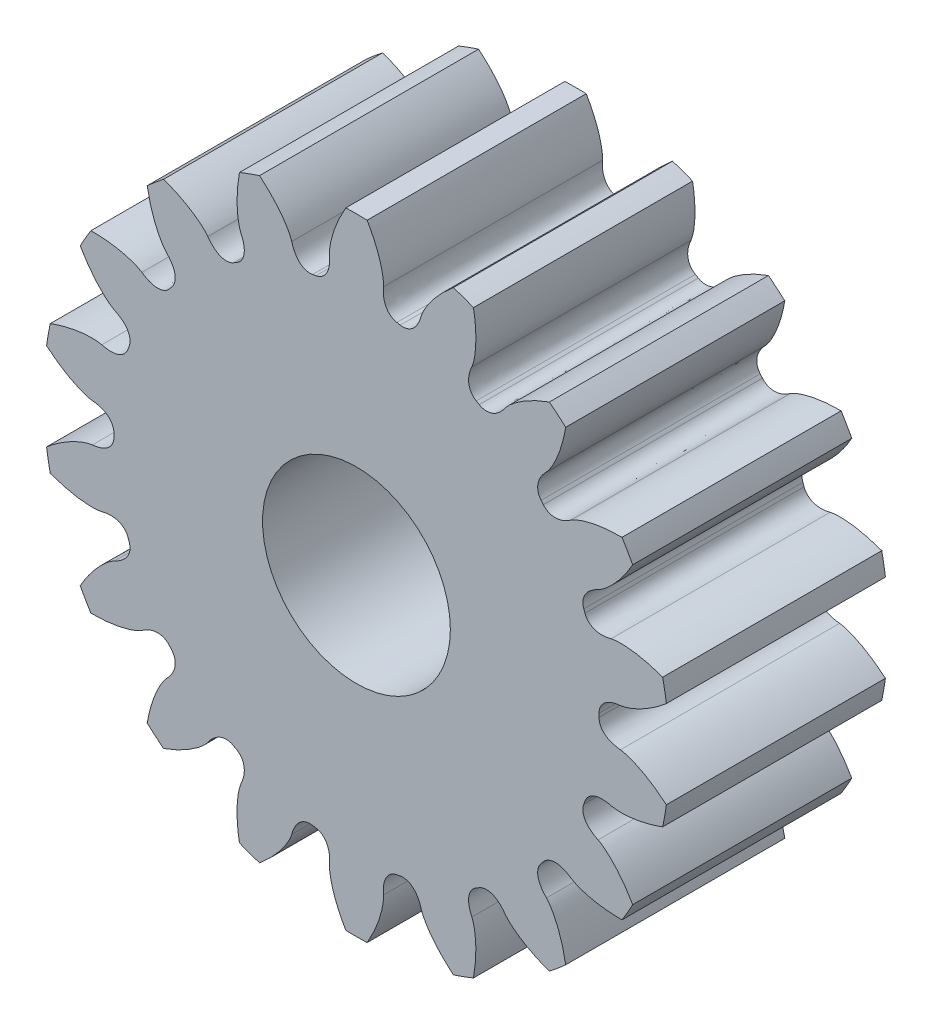
from build123d import *

# Parameters (mm, degrees)
EXTRUDE1_DEPTH = 3.5
SKETCH2_R      = 1.5
EXTRUDE2_DEPTH = 8.858758403


with BuildPart() as part:
    # Model → Extrude1 (new body)
    with BuildSketch(Plane.XY):
        with BuildLine():
            ThreePointArc((0.170382954, 4.997096122), (0, 5), (-0.170382954, 4.997096122))
            add(Edge.make_bspline(
                [(-0.43135347, 4.207267466), (-0.431951062, 4.236199501), (-0.430964789, 4.264988509), (-0.428394651, 4.293634492), (-0.425770912, 4.322877894), (-0.420909378, 4.352020022), (-0.415571578, 4.380917537), (-0.41012826, 4.410386301), (-0.403350915, 4.43967045), (-0.395923916, 4.46870975), (-0.388353419, 4.498310119), (-0.379730019, 4.52768866), (-0.370476347, 4.556810235), (-0.361047462, 4.586483212), (-0.350716716, 4.615909272), (-0.339787808, 4.645065279), (-0.328655911, 4.67476282), (-0.316719407, 4.704193559), (-0.304215266, 4.733341371), (-0.291483172, 4.763020553), (-0.278015717, 4.792415808), (-0.26400773, 4.821515626), (-0.249748986, 4.85113636), (-0.234807532, 4.880457696), (-0.219349459, 4.909471425), (-0.203619566, 4.938995344), (-0.187297397, 4.968203576), (-0.170382954, 4.997096122)],
                knots=[0, 0, 0, 0, 1, 1, 1, 2, 2, 2, 3, 3, 3, 4, 4, 4, 5, 5, 5, 6, 6, 6, 7, 7, 7, 8, 8, 8, 9, 9, 9, 9], degree=3))
            add(Edge.make_bspline(
                [(-0.43135347, 4.207267466), (-0.426410983, 4.162768285), (-0.427129765, 4.118945491), (-0.433509815, 4.075799084), (-0.437167481, 4.051063365), (-0.442075917, 4.025979343), (-0.450064877, 4.00225885), (-0.45584876, 3.98508558), (-0.46276282, 3.967979094), (-0.471301457, 3.951985875), (-0.478339128, 3.938804027), (-0.486355451, 3.925906001), (-0.495389481, 3.913998251), (-0.503410661, 3.903425539), (-0.512275301, 3.893279379), (-0.52182913, 3.884065211), (-0.530697966, 3.875511683), (-0.540288786, 3.867492833), (-0.550350294, 3.860378481), (-0.559957369, 3.853585452), (-0.570172172, 3.847415715), (-0.580688018, 3.842136144), (-0.590923912, 3.836997125), (-0.601655598, 3.832557088), (-0.612541957, 3.828996435), (-0.623293412, 3.825479906), (-0.634306636, 3.822762449), (-0.645581629, 3.820844064)],
                knots=[0, 0, 0, 0, 1, 1, 1, 2, 2, 2, 3, 3, 3, 4, 4, 4, 5, 5, 5, 6, 6, 6, 7, 7, 7, 8, 8, 8, 9, 9, 9, 9], degree=3))
            ThreePointArc((-0.645581629, 3.820844064), (-0.672886688, 3.816130043), (-0.700157341, 3.811220893))
            add(Edge.make_bspline(
                [(-1.033630549, 4.101069767), (-1.023055352, 4.057563785), (-1.007391639, 4.016629667), (-0.986639413, 3.978267412), (-0.974742217, 3.956274435), (-0.961550555, 3.934381948), (-0.945930501, 3.914824361), (-0.934621825, 3.900664971), (-0.922273971, 3.88695488), (-0.908780274, 3.874846556), (-0.897658569, 3.864866696), (-0.885714305, 3.85548826), (-0.873152403, 3.847388455), (-0.861998879, 3.840196761), (-0.850198651, 3.833694375), (-0.838069558, 3.828303491), (-0.826810099, 3.823299124), (-0.815055067, 3.819044124), (-0.803167091, 3.815800059), (-0.791816041, 3.812702513), (-0.780107092, 3.810398525), (-0.768419709, 3.809033981), (-0.757043467, 3.807705765), (-0.745440399, 3.807203948), (-0.733992753, 3.807581383), (-0.722686966, 3.807954141), (-0.711408495, 3.809167311), (-0.700157341, 3.811220893)],
                knots=[0, 0, 0, 0, 1, 1, 1, 2, 2, 2, 3, 3, 3, 4, 4, 4, 5, 5, 5, 6, 6, 6, 7, 7, 7, 8, 8, 8, 9, 9, 9, 9], degree=3))
            add(Edge.make_bspline(
                [(-1.033630549, 4.101069767), (-1.042964335, 4.128461375), (-1.053737549, 4.155176869), (-1.065950192, 4.181216248), (-1.078417533, 4.207798686), (-1.092953075, 4.233520587), (-1.107852498, 4.258849733), (-1.123046455, 4.284679588), (-1.139430845, 4.309879699), (-1.156341967, 4.334627531), (-1.17357983, 4.359853517), (-1.191731228, 4.384510939), (-1.210387, 4.408711326), (-1.229396009, 4.433369934), (-1.249168041, 4.457488062), (-1.269409797, 4.481147841), (-1.290027516, 4.505247067), (-1.311310066, 4.528820391), (-1.333029253, 4.551933707), (-1.355144386, 4.575468383), (-1.377853424, 4.598484746), (-1.400969349, 4.621038616), (-1.424499074, 4.643996224), (-1.448567936, 4.666438989), (-1.473017052, 4.688416004), (-1.497896092, 4.710779472), (-1.523223717, 4.732643722), (-1.548999928, 4.754008753)],
                knots=[0, 0, 0, 0, 1, 1, 1, 2, 2, 2, 3, 3, 3, 4, 4, 4, 5, 5, 5, 6, 6, 6, 7, 7, 7, 8, 8, 8, 9, 9, 9, 9], degree=3))
            ThreePointArc((-1.548999928, 4.754008753), (-1.710100717, 4.698463104), (-1.869215136, 4.637459949))
            add(Edge.make_bspline(
                [(-1.844309894, 3.806006616), (-1.854766786, 3.832989447), (-1.863686414, 3.860379591), (-1.871068777, 3.888177048), (-1.878605101, 3.91655423), (-1.884003949, 3.945601615), (-1.888871589, 3.974582031), (-1.893835454, 4.004135335), (-1.897482602, 4.033971423), (-1.900435531, 4.063799622), (-1.903445513, 4.094204133), (-1.905390221, 4.124760307), (-1.90665478, 4.155290579), (-1.907943282, 4.186398925), (-1.908299861, 4.2175837), (-1.908001988, 4.248719291), (-1.907698584, 4.280433184), (-1.906547845, 4.312171557), (-1.904766935, 4.343838209), (-1.902953558, 4.37608215), (-1.90035206, 4.408310795), (-1.897141581, 4.440446693), (-1.893873632, 4.473157856), (-1.889861745, 4.505821177), (-1.885259189, 4.538372137), (-1.880575699, 4.571495486), (-1.875227681, 4.604524757), (-1.869215136, 4.637459949)],
                knots=[0, 0, 0, 0, 1, 1, 1, 2, 2, 2, 3, 3, 3, 4, 4, 4, 5, 5, 5, 6, 6, 6, 7, 7, 7, 8, 8, 8, 9, 9, 9, 9], degree=3))
            add(Edge.make_bspline(
                [(-1.844309894, 3.806006616), (-1.824445859, 3.765881494), (-1.810133015, 3.7244557), (-1.801371361, 3.681729234), (-1.796348328, 3.657234266), (-1.792381509, 3.631984211), (-1.791775789, 3.606961854), (-1.791337258, 3.588846055), (-1.791983586, 3.570406468), (-1.794537277, 3.552457372), (-1.796642067, 3.537663462), (-1.799763561, 3.522801538), (-1.804180083, 3.508522093), (-1.808101446, 3.495843588), (-1.812961291, 3.483277431), (-1.818787523, 3.471351344), (-1.824196023, 3.460280336), (-1.830465839, 3.449464828), (-1.837487312, 3.439338286), (-1.844191657, 3.429669113), (-1.851680257, 3.420377789), (-1.8597562, 3.411819983), (-1.867617146, 3.403490003), (-1.87618305, 3.39564728), (-1.885195066, 3.388578007), (-1.894095406, 3.381596337), (-1.903515026, 3.375276018), (-1.913453928, 3.369617051)],
                knots=[0, 0, 0, 0, 1, 1, 1, 2, 2, 2, 3, 3, 3, 4, 4, 4, 5, 5, 5, 6, 6, 6, 7, 7, 7, 8, 8, 8, 9, 9, 9, 9], degree=3))
            ThreePointArc((-1.913453928, 3.369617051), (-1.9375, 3.35584844), (-1.961447003, 3.341908235))
            add(Edge.make_bspline(
                [(-2.373943469, 3.500222529), (-2.349126112, 3.462957209), (-2.320406744, 3.429849025), (-2.287785366, 3.400897977), (-2.269083617, 3.384300419), (-2.249199838, 3.368240026), (-2.227832701, 3.355204278), (-2.212363225, 3.345766599), (-2.19607091, 3.337106542), (-2.179249692, 3.330343556), (-2.165385394, 3.324769402), (-2.150953843, 3.320041734), (-2.136379221, 3.316726831), (-2.123438632, 3.313783578), (-2.110126099, 3.31170925), (-2.096884688, 3.31079187), (-2.084592663, 3.309940266), (-2.072091251, 3.309962331), (-2.059810672, 3.310979834), (-2.048084751, 3.311951381), (-2.036293927, 3.313791036), (-2.024844678, 3.316506106), (-2.013700231, 3.319148895), (-2.002625282, 3.322645824), (-1.991997104, 3.326915822), (-1.98150063, 3.331132907), (-1.971317263, 3.336130378), (-1.961447003, 3.341908235)],
                knots=[0, 0, 0, 0, 1, 1, 1, 2, 2, 2, 3, 3, 3, 4, 4, 4, 5, 5, 5, 6, 6, 6, 7, 7, 7, 8, 8, 8, 9, 9, 9, 9], degree=3))
            add(Edge.make_bspline(
                [(-2.373943469, 3.500222529), (-2.39208284, 3.522769878), (-2.411343587, 3.544189574), (-2.43172571, 3.564481617), (-2.452532908, 3.585196856), (-2.474989257, 3.604396088), (-2.497653214, 3.623101797), (-2.520765194, 3.642177282), (-2.544780429, 3.660253848), (-2.569135943, 3.677725259), (-2.593962031, 3.695534236), (-2.6194521, 3.712496489), (-2.645259812, 3.728856765), (-2.671556178, 3.745526813), (-2.698384696, 3.761428007), (-2.725497846, 3.776737838), (-2.753114585, 3.792332028), (-2.781176191, 3.807204646), (-2.809490771, 3.821495658), (-2.838321532, 3.836047199), (-2.867533107, 3.849908557), (-2.89696885, 3.863196151), (-2.926931522, 3.876721605), (-2.957224732, 3.88957887), (-2.987715968, 3.901868418), (-3.018743375, 3.914374072), (-3.050021571, 3.926257188), (-3.081550557, 3.937517767)],
                knots=[0, 0, 0, 0, 1, 1, 1, 2, 2, 2, 3, 3, 3, 4, 4, 4, 5, 5, 5, 6, 6, 6, 7, 7, 7, 8, 8, 8, 9, 9, 9, 9], degree=3))
            ThreePointArc((-3.081550557, 3.937517767), (-3.213938048, 3.830222216), (-3.342592386, 3.718477664))
            add(Edge.make_bspline(
                [(-3.034815326, 2.945685197), (-3.053870262, 2.967464297), (-3.071619951, 2.990151921), (-3.088064394, 3.013748069), (-3.10485179, 3.037836323), (-3.119859838, 3.063285421), (-3.13434581, 3.088853274), (-3.149118143, 3.114926554), (-3.162749884, 3.141715907), (-3.175726574, 3.168735285), (-3.188953987, 3.196276704), (-3.201232242, 3.224324987), (-3.212862506, 3.252581553), (-3.224712983, 3.281373143), (-3.235713879, 3.310555288), (-3.24608297, 3.339915052), (-3.256644653, 3.369820134), (-3.266418475, 3.400038025), (-3.2755756, 3.430404051), (-3.284899661, 3.461323655), (-3.293477897, 3.492498441), (-3.301452159, 3.523794355), (-3.309569168, 3.555650497), (-3.316970741, 3.587716126), (-3.323778837, 3.619878189), (-3.330706648, 3.652605804), (-3.336977831, 3.685472296), (-3.342592386, 3.718477664)],
                knots=[0, 0, 0, 0, 1, 1, 1, 2, 2, 2, 3, 3, 3, 4, 4, 4, 5, 5, 5, 6, 6, 6, 7, 7, 7, 8, 8, 8, 9, 9, 9, 9], degree=3))
            add(Edge.make_bspline(
                [(-3.034815326, 2.945685197), (-3.002425639, 2.914773816), (-2.974807509, 2.880741585), (-2.951960936, 2.843588502), (-2.938863056, 2.822288739), (-2.926499438, 2.799918181), (-2.917372097, 2.776612025), (-2.910764044, 2.759738729), (-2.905064684, 2.742190128), (-2.901325417, 2.724450082), (-2.898243457, 2.709828473), (-2.896093624, 2.694795218), (-2.895359939, 2.67986639), (-2.894708511, 2.666611307), (-2.894977393, 2.653140818), (-2.896373298, 2.639941273), (-2.897669118, 2.627688112), (-2.899861696, 2.615380456), (-2.902996241, 2.603463134), (-2.905989213, 2.592084063), (-2.909848375, 2.580791821), (-2.914510337, 2.569987979), (-2.919048189, 2.559471757), (-2.924415137, 2.549172296), (-2.930465828, 2.539447062), (-2.93644154, 2.529842342), (-2.943131411, 2.520681485), (-2.950535442, 2.511964491)],
                knots=[0, 0, 0, 0, 1, 1, 1, 2, 2, 2, 3, 3, 3, 4, 4, 4, 5, 5, 5, 6, 6, 6, 7, 7, 7, 8, 8, 8, 9, 9, 9, 9], degree=3))
            ThreePointArc((-2.950535442, 2.511964491), (-2.968422217, 2.490801988), (-2.986157208, 2.469512123))
            add(Edge.make_bspline(
                [(-3.427923771, 2.477196796), (-3.391857593, 2.450666886), (-3.35354655, 2.429377972), (-3.31299064, 2.413330055), (-3.289740046, 2.404129826), (-3.265562427, 2.395838646), (-3.241025398, 2.390897042), (-3.223260969, 2.387319397), (-3.204989287, 2.384753905), (-3.186869435, 2.384151972), (-3.171934784, 2.38365585), (-3.156756604, 2.384149176), (-3.141927175, 2.386019001), (-3.128760348, 2.38767919), (-3.115541196, 2.390283114), (-3.102784578, 2.393949888), (-3.090942587, 2.397353761), (-3.079202649, 2.401650231), (-3.068010686, 2.406806576), (-3.057324213, 2.411730033), (-3.046873662, 2.417491443), (-3.037043496, 2.423958647), (-3.027475028, 2.430253682), (-3.018264, 2.437327576), (-3.009737206, 2.444975113), (-3.001316074, 2.452527882), (-2.993456075, 2.460706885), (-2.986157208, 2.469512123)],
                knots=[0, 0, 0, 0, 1, 1, 1, 2, 2, 2, 3, 3, 3, 4, 4, 4, 5, 5, 5, 6, 6, 6, 7, 7, 7, 8, 8, 8, 9, 9, 9, 9], degree=3))
            add(Edge.make_bspline(
                [(-3.427923771, 2.477196796), (-3.452680852, 2.492180344), (-3.478106001, 2.505720711), (-3.504199219, 2.517817897), (-3.530836618, 2.530167373), (-3.558505208, 2.540528226), (-3.58620009, 2.550354312), (-3.614442447, 2.560374642), (-3.643191937, 2.569147364), (-3.672054208, 2.577235044), (-3.701474128, 2.585478986), (-3.73122839, 2.592700173), (-3.76107525, 2.599247046), (-3.791487244, 2.60591788), (-3.822136333, 2.611684221), (-3.85285063, 2.616797513), (-3.884135403, 2.622005777), (-3.915591423, 2.626383832), (-3.947086239, 2.630128834), (-3.979155211, 2.633942109), (-4.011345977, 2.636976578), (-4.043551152, 2.639395214), (-4.076332832, 2.641857146), (-4.109196581, 2.643578135), (-4.142052244, 2.644697917), (-4.175485654, 2.645837388), (-4.20894181, 2.646306092), (-4.24242071, 2.646104027)],
                knots=[0, 0, 0, 0, 1, 1, 1, 2, 2, 2, 3, 3, 3, 4, 4, 4, 5, 5, 5, 6, 6, 6, 7, 7, 7, 8, 8, 8, 9, 9, 9, 9], degree=3))
            ThreePointArc((-4.24242071, 2.646104027), (-4.330127019, 2.5), (-4.412803663, 2.350992095))
            add(Edge.make_bspline(
                [(-3.859277241, 1.73007067), (-3.884631914, 1.744019157), (-3.909070791, 1.759267799), (-3.93259387, 1.775816595), (-3.95660753, 1.792710521), (-3.979414586, 1.811491797), (-4.001771668, 1.830563225), (-4.024570707, 1.850011658), (-4.046542852, 1.870523086), (-4.067978123, 1.891474706), (-4.089827546, 1.912831133), (-4.11095841, 1.934988487), (-4.131551598, 1.957563189), (-4.152534707, 1.980565332), (-4.172853049, 2.00422505), (-4.192638438, 2.028267766), (-4.212791314, 2.052757042), (-4.23231083, 2.077809727), (-4.251301505, 2.103212537), (-4.270638384, 2.129078444), (-4.289361694, 2.15543923), (-4.307558882, 2.182120412), (-4.326081818, 2.209279213), (-4.344004113, 2.236879561), (-4.361401703, 2.264773509), (-4.37910522, 2.293157956), (-4.396239207, 2.321897484), (-4.412803663, 2.350992095)],
                knots=[0, 0, 0, 0, 1, 1, 1, 2, 2, 2, 3, 3, 3, 4, 4, 4, 5, 5, 5, 6, 6, 6, 7, 7, 7, 8, 8, 8, 9, 9, 9, 9], degree=3))
            add(Edge.make_bspline(
                [(-3.859277241, 1.73007067), (-3.818268576, 1.712101399), (-3.780676314, 1.689567519), (-3.746500455, 1.662469029), (-3.726907527, 1.646933538), (-3.707638344, 1.630140697), (-3.691090275, 1.611361808), (-3.679109729, 1.597766184), (-3.667752107, 1.583225188), (-3.658170892, 1.567833903), (-3.650273912, 1.555148177), (-3.643112055, 1.541756825), (-3.637316656, 1.52797925), (-3.632171009, 1.515746348), (-3.627816497, 1.502996265), (-3.624613707, 1.490115323), (-3.621640553, 1.478157921), (-3.619491436, 1.465842602), (-3.61836098, 1.453571905), (-3.617281582, 1.441855419), (-3.617045834, 1.429924272), (-3.617731514, 1.418177497), (-3.61839894, 1.406743443), (-3.619919599, 1.395229511), (-3.622279162, 1.384021322), (-3.624609487, 1.372952024), (-3.627762712, 1.362055564), (-3.631738838, 1.351331941)],
                knots=[0, 0, 0, 0, 1, 1, 1, 2, 2, 2, 3, 3, 3, 4, 4, 4, 5, 5, 5, 6, 6, 6, 7, 7, 7, 8, 8, 8, 9, 9, 9, 9], degree=3))
            ThreePointArc((-3.631738838, 1.351331941), (-3.641308906, 1.325328055), (-3.650692784, 1.299256403))
            add(Edge.make_bspline(
                [(-4.068445875, 1.15538457), (-4.025480991, 1.142789968), (-3.982199149, 1.135888082), (-3.938600348, 1.13467891), (-3.913605273, 1.133985695), (-3.888049993, 1.134463767), (-3.863302599, 1.138212336), (-3.845385869, 1.140926242), (-3.827338655, 1.144764752), (-3.81010569, 1.150396474), (-3.795902025, 1.155038224), (-3.781807929, 1.160693041), (-3.768512342, 1.167522065), (-3.75670739, 1.173585453), (-3.745176045, 1.180553557), (-3.734442856, 1.188362218), (-3.724479217, 1.195611012), (-3.714916763, 1.203663668), (-3.706163332, 1.212336925), (-3.697805254, 1.22061845), (-3.689955467, 1.229606703), (-3.682930046, 1.239046002), (-3.676091656, 1.248234008), (-3.669855536, 1.258031652), (-3.664458581, 1.268134322), (-3.659128505, 1.278111799), (-3.654539906, 1.288485826), (-3.650692784, 1.299256403)],
                knots=[0, 0, 0, 0, 1, 1, 1, 2, 2, 2, 3, 3, 3, 4, 4, 4, 5, 5, 5, 6, 6, 6, 7, 7, 7, 8, 8, 8, 9, 9, 9, 9], degree=3))
            add(Edge.make_bspline(
                [(-4.068445875, 1.15538457), (-4.096834597, 1.160997079), (-4.1253575, 1.165024948), (-4.154014586, 1.167468179), (-4.183269323, 1.169962364), (-4.212812913, 1.170235165), (-4.242198309, 1.169996459), (-4.272164598, 1.169753034), (-4.302180729, 1.168163792), (-4.332068541, 1.165892246), (-4.362533817, 1.163576812), (-4.39296347, 1.160185952), (-4.423249506, 1.156129773), (-4.454108992, 1.151996792), (-4.48488192, 1.146932774), (-4.515492767, 1.141232789), (-4.546672168, 1.135426933), (-4.577728541, 1.128782367), (-4.608604853, 1.121529656), (-4.640044047, 1.114144727), (-4.671331321, 1.105986306), (-4.702421508, 1.097244262), (-4.734068242, 1.088345726), (-4.765538677, 1.078722863), (-4.796795889, 1.068537814), (-4.82860274, 1.058173668), (-4.860201549, 1.047171426), (-4.891592314, 1.035531089)],
                knots=[0, 0, 0, 0, 1, 1, 1, 2, 2, 2, 3, 3, 3, 4, 4, 4, 5, 5, 5, 6, 6, 6, 7, 7, 7, 8, 8, 8, 9, 9, 9, 9], degree=3))
            ThreePointArc((-4.891592314, 1.035531089), (-4.924038765, 0.868240888), (-4.950765693, 0.699942181))
            add(Edge.make_bspline(
                [(-4.218253363, 0.305784087), (-4.246849626, 0.310219568), (-4.275030001, 0.316190016), (-4.302794487, 0.323695431), (-4.331138009, 0.331357374), (-4.358993206, 0.341205527), (-4.386524803, 0.351480235), (-4.414600648, 0.361958054), (-4.442263032, 0.373717574), (-4.469571474, 0.386074363), (-4.497407544, 0.398669897), (-4.524842321, 0.412263818), (-4.551914591, 0.426433814), (-4.57949946, 0.440872112), (-4.606684557, 0.456155692), (-4.633499834, 0.471981453), (-4.660813168, 0.488101156), (-4.687724036, 0.504966911), (-4.714257706, 0.522342551), (-4.74127509, 0.540034951), (-4.767885166, 0.558402238), (-4.794110431, 0.577250542), (-4.820805154, 0.596436251), (-4.847086477, 0.616242308), (-4.872975156, 0.636503718), (-4.899319073, 0.657121414), (-4.925249252, 0.678267569), (-4.950765693, 0.699942181)],
                knots=[0, 0, 0, 0, 1, 1, 1, 2, 2, 2, 3, 3, 3, 4, 4, 4, 5, 5, 5, 6, 6, 6, 7, 7, 7, 8, 8, 8, 9, 9, 9, 9], degree=3))
            add(Edge.make_bspline(
                [(-4.218253363, 0.305784087), (-4.173571971, 0.302924285), (-4.130539759, 0.294606675), (-4.089156727, 0.280831257), (-4.065431946, 0.272933846), (-4.041581347, 0.263744186), (-4.01960849, 0.251757575), (-4.003700482, 0.243079456), (-3.988054496, 0.233299925), (-3.973786969, 0.222113816), (-3.962027461, 0.212894059), (-3.950717405, 0.202759804), (-3.940559303, 0.191795262), (-3.931540078, 0.18206001), (-3.92308739, 0.171568182), (-3.91567221, 0.160559473), (-3.908788686, 0.15034007), (-3.90255709, 0.139502497), (-3.897297983, 0.128358452), (-3.892276407, 0.117717733), (-3.887974184, 0.106586752), (-3.884600879, 0.095313877), (-3.881317377, 0.084341108), (-3.878808332, 0.073001456), (-3.87719217, 0.061662185), (-3.875596036, 0.05046343), (-3.874832289, 0.03914564), (-3.874900931, 0.027708815)],
                knots=[0, 0, 0, 0, 1, 1, 1, 2, 2, 2, 3, 3, 3, 4, 4, 4, 5, 5, 5, 6, 6, 6, 7, 7, 7, 8, 8, 8, 9, 9, 9, 9], degree=3))
            ThreePointArc((-3.874900931, 0.027708815), (-3.875, 0), (-3.874900931, -0.027708815))
            add(Edge.make_bspline(
                [(-4.218253363, -0.305784087), (-4.173571971, -0.302924285), (-4.130539759, -0.294606675), (-4.089156727, -0.280831257), (-4.065431946, -0.272933846), (-4.041581347, -0.263744186), (-4.01960849, -0.251757575), (-4.003700482, -0.243079456), (-3.988054496, -0.233299925), (-3.973786969, -0.222113816), (-3.962027461, -0.212894059), (-3.950717405, -0.202759804), (-3.940559303, -0.191795262), (-3.931540078, -0.18206001), (-3.92308739, -0.171568182), (-3.91567221, -0.160559473), (-3.908788686, -0.15034007), (-3.90255709, -0.139502497), (-3.897297983, -0.128358452), (-3.892276407, -0.117717733), (-3.887974184, -0.106586752), (-3.884600879, -0.095313877), (-3.881317377, -0.084341108), (-3.878808332, -0.073001456), (-3.87719217, -0.061662185), (-3.875596036, -0.05046343), (-3.874832289, -0.03914564), (-3.874900931, -0.027708815)],
                knots=[0, 0, 0, 0, 1, 1, 1, 2, 2, 2, 3, 3, 3, 4, 4, 4, 5, 5, 5, 6, 6, 6, 7, 7, 7, 8, 8, 8, 9, 9, 9, 9], degree=3))
            add(Edge.make_bspline(
                [(-4.218253363, -0.305784087), (-4.246849626, -0.310219568), (-4.275030001, -0.316190016), (-4.302794487, -0.323695431), (-4.331138009, -0.331357374), (-4.358993206, -0.341205527), (-4.386524803, -0.351480235), (-4.414600648, -0.361958054), (-4.442263032, -0.373717574), (-4.469571474, -0.386074363), (-4.497407544, -0.398669897), (-4.524842321, -0.412263818), (-4.551914591, -0.426433814), (-4.57949946, -0.440872112), (-4.606684557, -0.456155692), (-4.633499834, -0.471981453), (-4.660813168, -0.488101156), (-4.687724036, -0.504966911), (-4.714257706, -0.522342551), (-4.74127509, -0.540034951), (-4.767885166, -0.558402238), (-4.794110431, -0.577250542), (-4.820805154, -0.596436251), (-4.847086477, -0.616242308), (-4.872975156, -0.636503718), (-4.899319073, -0.657121414), (-4.925249252, -0.678267569), (-4.950765693, -0.699942181)],
                knots=[0, 0, 0, 0, 1, 1, 1, 2, 2, 2, 3, 3, 3, 4, 4, 4, 5, 5, 5, 6, 6, 6, 7, 7, 7, 8, 8, 8, 9, 9, 9, 9], degree=3))
            ThreePointArc((-4.950765693, -0.699942181), (-4.924038765, -0.868240888), (-4.891592314, -1.035531089))
            add(Edge.make_bspline(
                [(-4.068445875, -1.15538457), (-4.096834597, -1.160997079), (-4.1253575, -1.165024948), (-4.154014586, -1.167468179), (-4.183269323, -1.169962364), (-4.212812913, -1.170235165), (-4.242198309, -1.169996459), (-4.272164598, -1.169753034), (-4.302180729, -1.168163792), (-4.332068541, -1.165892246), (-4.362533817, -1.163576812), (-4.39296347, -1.160185952), (-4.423249506, -1.156129773), (-4.454108992, -1.151996792), (-4.48488192, -1.146932774), (-4.515492767, -1.141232789), (-4.546672168, -1.135426933), (-4.577728541, -1.128782367), (-4.608604853, -1.121529656), (-4.640044047, -1.114144727), (-4.671331321, -1.105986306), (-4.702421508, -1.097244262), (-4.734068242, -1.088345726), (-4.765538677, -1.078722863), (-4.796795889, -1.068537814), (-4.82860274, -1.058173668), (-4.860201549, -1.047171426), (-4.891592314, -1.035531089)],
                knots=[0, 0, 0, 0, 1, 1, 1, 2, 2, 2, 3, 3, 3, 4, 4, 4, 5, 5, 5, 6, 6, 6, 7, 7, 7, 8, 8, 8, 9, 9, 9, 9], degree=3))
            add(Edge.make_bspline(
                [(-4.068445875, -1.15538457), (-4.025480991, -1.142789968), (-3.982199149, -1.135888082), (-3.938600348, -1.13467891), (-3.913605273, -1.133985695), (-3.888049993, -1.134463767), (-3.863302599, -1.138212336), (-3.845385869, -1.140926242), (-3.827338655, -1.144764752), (-3.81010569, -1.150396474), (-3.795902025, -1.155038224), (-3.781807929, -1.160693041), (-3.768512342, -1.167522065), (-3.75670739, -1.173585453), (-3.745176045, -1.180553557), (-3.734442856, -1.188362218), (-3.724479217, -1.195611012), (-3.714916763, -1.203663668), (-3.706163332, -1.212336925), (-3.697805254, -1.22061845), (-3.689955467, -1.229606703), (-3.682930046, -1.239046002), (-3.676091656, -1.248234008), (-3.669855536, -1.258031652), (-3.664458581, -1.268134322), (-3.659128505, -1.278111799), (-3.654539906, -1.288485826), (-3.650692784, -1.299256403)],
                knots=[0, 0, 0, 0, 1, 1, 1, 2, 2, 2, 3, 3, 3, 4, 4, 4, 5, 5, 5, 6, 6, 6, 7, 7, 7, 8, 8, 8, 9, 9, 9, 9], degree=3))
            ThreePointArc((-3.650692784, -1.299256403), (-3.641308906, -1.325328055), (-3.631738838, -1.351331941))
            add(Edge.make_bspline(
                [(-3.859277241, -1.73007067), (-3.818268576, -1.712101399), (-3.780676314, -1.689567519), (-3.746500455, -1.662469029), (-3.726907527, -1.646933538), (-3.707638344, -1.630140697), (-3.691090275, -1.611361808), (-3.679109729, -1.597766184), (-3.667752107, -1.583225188), (-3.658170892, -1.567833903), (-3.650273912, -1.555148177), (-3.643112055, -1.541756825), (-3.637316656, -1.52797925), (-3.632171009, -1.515746348), (-3.627816497, -1.502996265), (-3.624613707, -1.490115323), (-3.621640553, -1.478157921), (-3.619491436, -1.465842602), (-3.61836098, -1.453571905), (-3.617281582, -1.441855419), (-3.617045834, -1.429924272), (-3.617731514, -1.418177497), (-3.61839894, -1.406743443), (-3.619919599, -1.395229511), (-3.622279162, -1.384021322), (-3.624609487, -1.372952024), (-3.627762712, -1.362055564), (-3.631738838, -1.351331941)],
                knots=[0, 0, 0, 0, 1, 1, 1, 2, 2, 2, 3, 3, 3, 4, 4, 4, 5, 5, 5, 6, 6, 6, 7, 7, 7, 8, 8, 8, 9, 9, 9, 9], degree=3))
            add(Edge.make_bspline(
                [(-3.859277241, -1.73007067), (-3.884631914, -1.744019157), (-3.909070791, -1.759267799), (-3.93259387, -1.775816595), (-3.95660753, -1.792710521), (-3.979414586, -1.811491797), (-4.001771668, -1.830563225), (-4.024570707, -1.850011658), (-4.046542852, -1.870523086), (-4.067978123, -1.891474706), (-4.089827546, -1.912831133), (-4.11095841, -1.934988487), (-4.131551598, -1.957563189), (-4.152534707, -1.980565332), (-4.172853049, -2.00422505), (-4.192638438, -2.028267766), (-4.212791314, -2.052757042), (-4.23231083, -2.077809727), (-4.251301505, -2.103212537), (-4.270638384, -2.129078444), (-4.289361694, -2.15543923), (-4.307558882, -2.182120412), (-4.326081818, -2.209279213), (-4.344004113, -2.236879561), (-4.361401703, -2.264773509), (-4.37910522, -2.293157956), (-4.396239207, -2.321897484), (-4.412803663, -2.350992095)],
                knots=[0, 0, 0, 0, 1, 1, 1, 2, 2, 2, 3, 3, 3, 4, 4, 4, 5, 5, 5, 6, 6, 6, 7, 7, 7, 8, 8, 8, 9, 9, 9, 9], degree=3))
            ThreePointArc((-4.412803663, -2.350992095), (-4.330127019, -2.5), (-4.24242071, -2.646104027))
            add(Edge.make_bspline(
                [(-3.427923771, -2.477196796), (-3.452680852, -2.492180344), (-3.478106001, -2.505720711), (-3.504199219, -2.517817897), (-3.530836618, -2.530167373), (-3.558505208, -2.540528226), (-3.58620009, -2.550354312), (-3.614442447, -2.560374642), (-3.643191937, -2.569147364), (-3.672054208, -2.577235044), (-3.701474128, -2.585478986), (-3.73122839, -2.592700173), (-3.76107525, -2.599247046), (-3.791487244, -2.60591788), (-3.822136333, -2.611684221), (-3.85285063, -2.616797513), (-3.884135403, -2.622005777), (-3.915591423, -2.626383832), (-3.947086239, -2.630128834), (-3.979155211, -2.633942109), (-4.011345977, -2.636976578), (-4.043551152, -2.639395214), (-4.076332832, -2.641857146), (-4.109196581, -2.643578135), (-4.142052244, -2.644697917), (-4.175485654, -2.645837388), (-4.20894181, -2.646306092), (-4.24242071, -2.646104027)],
                knots=[0, 0, 0, 0, 1, 1, 1, 2, 2, 2, 3, 3, 3, 4, 4, 4, 5, 5, 5, 6, 6, 6, 7, 7, 7, 8, 8, 8, 9, 9, 9, 9], degree=3))
            add(Edge.make_bspline(
                [(-3.427923771, -2.477196796), (-3.391857593, -2.450666886), (-3.35354655, -2.429377972), (-3.31299064, -2.413330055), (-3.289740046, -2.404129826), (-3.265562427, -2.395838646), (-3.241025398, -2.390897042), (-3.223260969, -2.387319397), (-3.204989287, -2.384753905), (-3.186869435, -2.384151972), (-3.171934784, -2.38365585), (-3.156756604, -2.384149176), (-3.141927175, -2.386019001), (-3.128760348, -2.38767919), (-3.115541196, -2.390283114), (-3.102784578, -2.393949888), (-3.090942587, -2.397353761), (-3.079202649, -2.401650231), (-3.068010686, -2.406806576), (-3.057324213, -2.411730033), (-3.046873662, -2.417491443), (-3.037043496, -2.423958647), (-3.027475028, -2.430253682), (-3.018264, -2.437327576), (-3.009737206, -2.444975113), (-3.001316074, -2.452527882), (-2.993456075, -2.460706885), (-2.986157208, -2.469512123)],
                knots=[0, 0, 0, 0, 1, 1, 1, 2, 2, 2, 3, 3, 3, 4, 4, 4, 5, 5, 5, 6, 6, 6, 7, 7, 7, 8, 8, 8, 9, 9, 9, 9], degree=3))
            ThreePointArc((-2.986157208, -2.469512123), (-2.968422217, -2.490801988), (-2.950535442, -2.511964491))
            add(Edge.make_bspline(
                [(-3.034815326, -2.945685197), (-3.002425639, -2.914773816), (-2.974807509, -2.880741585), (-2.951960936, -2.843588502), (-2.938863056, -2.822288739), (-2.926499438, -2.799918181), (-2.917372097, -2.776612025), (-2.910764044, -2.759738729), (-2.905064684, -2.742190128), (-2.901325417, -2.724450082), (-2.898243457, -2.709828473), (-2.896093624, -2.694795218), (-2.895359939, -2.67986639), (-2.894708511, -2.666611307), (-2.894977393, -2.653140818), (-2.896373298, -2.639941273), (-2.897669118, -2.627688112), (-2.899861696, -2.615380456), (-2.902996241, -2.603463134), (-2.905989213, -2.592084063), (-2.909848375, -2.580791821), (-2.914510337, -2.569987979), (-2.919048189, -2.559471757), (-2.924415137, -2.549172296), (-2.930465828, -2.539447062), (-2.93644154, -2.529842342), (-2.943131411, -2.520681485), (-2.950535442, -2.511964491)],
                knots=[0, 0, 0, 0, 1, 1, 1, 2, 2, 2, 3, 3, 3, 4, 4, 4, 5, 5, 5, 6, 6, 6, 7, 7, 7, 8, 8, 8, 9, 9, 9, 9], degree=3))
            add(Edge.make_bspline(
                [(-3.034815326, -2.945685197), (-3.053870262, -2.967464297), (-3.071619951, -2.990151921), (-3.088064394, -3.013748069), (-3.10485179, -3.037836323), (-3.119859838, -3.063285421), (-3.13434581, -3.088853274), (-3.149118143, -3.114926554), (-3.162749884, -3.141715907), (-3.175726574, -3.168735285), (-3.188953987, -3.196276704), (-3.201232242, -3.224324987), (-3.212862506, -3.252581553), (-3.224712983, -3.281373143), (-3.235713879, -3.310555288), (-3.24608297, -3.339915052), (-3.256644653, -3.369820134), (-3.266418475, -3.400038025), (-3.2755756, -3.430404051), (-3.284899661, -3.461323655), (-3.293477897, -3.492498441), (-3.301452159, -3.523794355), (-3.309569168, -3.555650497), (-3.316970741, -3.587716126), (-3.323778837, -3.619878189), (-3.330706648, -3.652605804), (-3.336977831, -3.685472296), (-3.342592386, -3.718477664)],
                knots=[0, 0, 0, 0, 1, 1, 1, 2, 2, 2, 3, 3, 3, 4, 4, 4, 5, 5, 5, 6, 6, 6, 7, 7, 7, 8, 8, 8, 9, 9, 9, 9], degree=3))
            ThreePointArc((-3.342592386, -3.718477664), (-3.213938048, -3.830222216), (-3.081550557, -3.937517767))
            add(Edge.make_bspline(
                [(-2.373943469, -3.500222529), (-2.39208284, -3.522769878), (-2.411343587, -3.544189574), (-2.43172571, -3.564481617), (-2.452532908, -3.585196856), (-2.474989257, -3.604396088), (-2.497653214, -3.623101797), (-2.520765194, -3.642177282), (-2.544780429, -3.660253848), (-2.569135943, -3.677725259), (-2.593962031, -3.695534236), (-2.6194521, -3.712496489), (-2.645259812, -3.728856765), (-2.671556178, -3.745526813), (-2.698384696, -3.761428007), (-2.725497846, -3.776737838), (-2.753114585, -3.792332028), (-2.781176191, -3.807204646), (-2.809490771, -3.821495658), (-2.838321532, -3.836047199), (-2.867533107, -3.849908557), (-2.89696885, -3.863196151), (-2.926931522, -3.876721605), (-2.957224732, -3.88957887), (-2.987715968, -3.901868418), (-3.018743375, -3.914374072), (-3.050021571, -3.926257188), (-3.081550557, -3.937517767)],
                knots=[0, 0, 0, 0, 1, 1, 1, 2, 2, 2, 3, 3, 3, 4, 4, 4, 5, 5, 5, 6, 6, 6, 7, 7, 7, 8, 8, 8, 9, 9, 9, 9], degree=3))
            add(Edge.make_bspline(
                [(-2.373943469, -3.500222529), (-2.349126112, -3.462957209), (-2.320406744, -3.429849025), (-2.287785366, -3.400897977), (-2.269083617, -3.384300419), (-2.249199838, -3.368240026), (-2.227832701, -3.355204278), (-2.212363225, -3.345766599), (-2.19607091, -3.337106542), (-2.179249692, -3.330343556), (-2.165385394, -3.324769402), (-2.150953843, -3.320041734), (-2.136379221, -3.316726831), (-2.123438632, -3.313783578), (-2.110126099, -3.31170925), (-2.096884688, -3.31079187), (-2.084592663, -3.309940266), (-2.072091251, -3.309962331), (-2.059810672, -3.310979834), (-2.048084751, -3.311951381), (-2.036293927, -3.313791036), (-2.024844678, -3.316506106), (-2.013700231, -3.319148895), (-2.002625282, -3.322645824), (-1.991997104, -3.326915822), (-1.98150063, -3.331132907), (-1.971317263, -3.336130378), (-1.961447003, -3.341908235)],
                knots=[0, 0, 0, 0, 1, 1, 1, 2, 2, 2, 3, 3, 3, 4, 4, 4, 5, 5, 5, 6, 6, 6, 7, 7, 7, 8, 8, 8, 9, 9, 9, 9], degree=3))
            ThreePointArc((-1.961447003, -3.341908235), (-1.9375, -3.35584844), (-1.913453928, -3.369617051))
            add(Edge.make_bspline(
                [(-1.844309894, -3.806006616), (-1.824445859, -3.765881494), (-1.810133015, -3.7244557), (-1.801371361, -3.681729234), (-1.796348328, -3.657234266), (-1.792381509, -3.631984211), (-1.791775789, -3.606961854), (-1.791337258, -3.588846055), (-1.791983586, -3.570406468), (-1.794537277, -3.552457372), (-1.796642067, -3.537663462), (-1.799763561, -3.522801538), (-1.804180083, -3.508522093), (-1.808101446, -3.495843588), (-1.812961291, -3.483277431), (-1.818787523, -3.471351344), (-1.824196023, -3.460280336), (-1.830465839, -3.449464828), (-1.837487312, -3.439338286), (-1.844191657, -3.429669113), (-1.851680257, -3.420377789), (-1.8597562, -3.411819983), (-1.867617146, -3.403490003), (-1.87618305, -3.39564728), (-1.885195066, -3.388578007), (-1.894095406, -3.381596337), (-1.903515026, -3.375276018), (-1.913453928, -3.369617051)],
                knots=[0, 0, 0, 0, 1, 1, 1, 2, 2, 2, 3, 3, 3, 4, 4, 4, 5, 5, 5, 6, 6, 6, 7, 7, 7, 8, 8, 8, 9, 9, 9, 9], degree=3))
            add(Edge.make_bspline(
                [(-1.844309894, -3.806006616), (-1.854766786, -3.832989447), (-1.863686414, -3.860379591), (-1.871068777, -3.888177048), (-1.878605101, -3.91655423), (-1.884003949, -3.945601615), (-1.888871589, -3.974582031), (-1.893835454, -4.004135335), (-1.897482602, -4.033971423), (-1.900435531, -4.063799622), (-1.903445513, -4.094204133), (-1.905390221, -4.124760307), (-1.90665478, -4.155290579), (-1.907943282, -4.186398925), (-1.908299861, -4.2175837), (-1.908001988, -4.248719291), (-1.907698584, -4.280433184), (-1.906547845, -4.312171557), (-1.904766935, -4.343838209), (-1.902953558, -4.37608215), (-1.90035206, -4.408310795), (-1.897141581, -4.440446693), (-1.893873632, -4.473157856), (-1.889861745, -4.505821177), (-1.885259189, -4.538372137), (-1.880575699, -4.571495486), (-1.875227681, -4.604524757), (-1.869215136, -4.637459949)],
                knots=[0, 0, 0, 0, 1, 1, 1, 2, 2, 2, 3, 3, 3, 4, 4, 4, 5, 5, 5, 6, 6, 6, 7, 7, 7, 8, 8, 8, 9, 9, 9, 9], degree=3))
            ThreePointArc((-1.869215136, -4.637459949), (-1.710100717, -4.698463104), (-1.548999928, -4.754008753))
            add(Edge.make_bspline(
                [(-1.033630549, -4.101069767), (-1.042964335, -4.128461375), (-1.053737549, -4.155176869), (-1.065950192, -4.181216248), (-1.078417533, -4.207798686), (-1.092953075, -4.233520587), (-1.107852498, -4.258849733), (-1.123046455, -4.284679588), (-1.139430845, -4.309879699), (-1.156341967, -4.334627531), (-1.17357983, -4.359853517), (-1.191731228, -4.384510939), (-1.210387, -4.408711326), (-1.229396009, -4.433369934), (-1.249168041, -4.457488062), (-1.269409797, -4.481147841), (-1.290027516, -4.505247067), (-1.311310066, -4.528820391), (-1.333029253, -4.551933707), (-1.355144386, -4.575468383), (-1.377853424, -4.598484746), (-1.400969349, -4.621038616), (-1.424499074, -4.643996224), (-1.448567936, -4.666438989), (-1.473017052, -4.688416004), (-1.497896092, -4.710779472), (-1.523223717, -4.732643722), (-1.548999928, -4.754008753)],
                knots=[0, 0, 0, 0, 1, 1, 1, 2, 2, 2, 3, 3, 3, 4, 4, 4, 5, 5, 5, 6, 6, 6, 7, 7, 7, 8, 8, 8, 9, 9, 9, 9], degree=3))
            add(Edge.make_bspline(
                [(-1.033630549, -4.101069767), (-1.023055352, -4.057563785), (-1.007391639, -4.016629667), (-0.986639413, -3.978267412), (-0.974742217, -3.956274435), (-0.961550555, -3.934381948), (-0.945930501, -3.914824361), (-0.934621825, -3.900664971), (-0.922273971, -3.88695488), (-0.908780274, -3.874846556), (-0.897658569, -3.864866696), (-0.885714305, -3.85548826), (-0.873152403, -3.847388455), (-0.861998879, -3.840196761), (-0.850198651, -3.833694375), (-0.838069558, -3.828303491), (-0.826810099, -3.823299124), (-0.815055067, -3.819044124), (-0.803167091, -3.815800059), (-0.791816041, -3.812702513), (-0.780107092, -3.810398525), (-0.768419709, -3.809033981), (-0.757043467, -3.807705765), (-0.745440399, -3.807203948), (-0.733992753, -3.807581383), (-0.722686966, -3.807954141), (-0.711408495, -3.809167311), (-0.700157341, -3.811220893)],
                knots=[0, 0, 0, 0, 1, 1, 1, 2, 2, 2, 3, 3, 3, 4, 4, 4, 5, 5, 5, 6, 6, 6, 7, 7, 7, 8, 8, 8, 9, 9, 9, 9], degree=3))
            ThreePointArc((-0.700157341, -3.811220893), (-0.672886688, -3.816130043), (-0.645581629, -3.820844064))
            add(Edge.make_bspline(
                [(-0.43135347, -4.207267466), (-0.426410983, -4.162768285), (-0.427129765, -4.118945491), (-0.433509815, -4.075799084), (-0.437167481, -4.051063365), (-0.442075917, -4.025979343), (-0.450064877, -4.00225885), (-0.45584876, -3.98508558), (-0.46276282, -3.967979094), (-0.471301457, -3.951985875), (-0.478339128, -3.938804027), (-0.486355451, -3.925906001), (-0.495389481, -3.913998251), (-0.503410661, -3.903425539), (-0.512275301, -3.893279379), (-0.52182913, -3.884065211), (-0.530697966, -3.875511683), (-0.540288786, -3.867492833), (-0.550350294, -3.860378481), (-0.559957369, -3.853585452), (-0.570172172, -3.847415715), (-0.580688018, -3.842136144), (-0.590923912, -3.836997125), (-0.601655598, -3.832557088), (-0.612541957, -3.828996435), (-0.623293412, -3.825479906), (-0.634306636, -3.822762449), (-0.645581629, -3.820844064)],
                knots=[0, 0, 0, 0, 1, 1, 1, 2, 2, 2, 3, 3, 3, 4, 4, 4, 5, 5, 5, 6, 6, 6, 7, 7, 7, 8, 8, 8, 9, 9, 9, 9], degree=3))
            add(Edge.make_bspline(
                [(-0.43135347, -4.207267466), (-0.431951062, -4.236199501), (-0.430964789, -4.264988509), (-0.428394651, -4.293634492), (-0.425770912, -4.322877894), (-0.420909378, -4.352020022), (-0.415571578, -4.380917537), (-0.41012826, -4.410386301), (-0.403350915, -4.43967045), (-0.395923916, -4.46870975), (-0.388353419, -4.498310119), (-0.379730019, -4.52768866), (-0.370476347, -4.556810235), (-0.361047462, -4.586483212), (-0.350716716, -4.615909272), (-0.339787808, -4.645065279), (-0.328655911, -4.67476282), (-0.316719407, -4.704193559), (-0.304215266, -4.733341371), (-0.291483172, -4.763020553), (-0.278015717, -4.792415808), (-0.26400773, -4.821515626), (-0.249748986, -4.85113636), (-0.234807532, -4.880457696), (-0.219349459, -4.909471425), (-0.203619566, -4.938995344), (-0.187297397, -4.968203576), (-0.170382954, -4.997096122)],
                knots=[0, 0, 0, 0, 1, 1, 1, 2, 2, 2, 3, 3, 3, 4, 4, 4, 5, 5, 5, 6, 6, 6, 7, 7, 7, 8, 8, 8, 9, 9, 9, 9], degree=3))
            ThreePointArc((-0.170382954, -4.997096122), (0, -5), (0.170382954, -4.997096122))
            add(Edge.make_bspline(
                [(0.43135347, -4.207267466), (0.431951062, -4.236199501), (0.430964789, -4.264988509), (0.428394651, -4.293634492), (0.425770912, -4.322877894), (0.420909378, -4.352020022), (0.415571578, -4.380917537), (0.41012826, -4.410386301), (0.403350915, -4.43967045), (0.395923916, -4.46870975), (0.388353419, -4.498310119), (0.379730019, -4.52768866), (0.370476347, -4.556810235), (0.361047462, -4.586483212), (0.350716716, -4.615909272), (0.339787808, -4.645065279), (0.328655911, -4.67476282), (0.316719407, -4.704193559), (0.304215266, -4.733341371), (0.291483172, -4.763020553), (0.278015717, -4.792415808), (0.26400773, -4.821515626), (0.249748986, -4.85113636), (0.234807532, -4.880457696), (0.219349459, -4.909471425), (0.203619566, -4.938995344), (0.187297397, -4.968203576), (0.170382954, -4.997096122)],
                knots=[0, 0, 0, 0, 1, 1, 1, 2, 2, 2, 3, 3, 3, 4, 4, 4, 5, 5, 5, 6, 6, 6, 7, 7, 7, 8, 8, 8, 9, 9, 9, 9], degree=3))
            add(Edge.make_bspline(
                [(0.43135347, -4.207267466), (0.426410983, -4.162768285), (0.427129765, -4.118945491), (0.433509815, -4.075799084), (0.437167481, -4.051063365), (0.442075917, -4.025979343), (0.450064877, -4.00225885), (0.45584876, -3.98508558), (0.46276282, -3.967979094), (0.471301457, -3.951985875), (0.478339128, -3.938804027), (0.486355451, -3.925906001), (0.495389481, -3.913998251), (0.503410661, -3.903425539), (0.512275301, -3.893279379), (0.52182913, -3.884065211), (0.530697966, -3.875511683), (0.540288786, -3.867492833), (0.550350294, -3.860378481), (0.559957369, -3.853585452), (0.570172172, -3.847415715), (0.580688018, -3.842136144), (0.590923912, -3.836997125), (0.601655598, -3.832557088), (0.612541957, -3.828996435), (0.623293412, -3.825479906), (0.634306636, -3.822762449), (0.645581629, -3.820844064)],
                knots=[0, 0, 0, 0, 1, 1, 1, 2, 2, 2, 3, 3, 3, 4, 4, 4, 5, 5, 5, 6, 6, 6, 7, 7, 7, 8, 8, 8, 9, 9, 9, 9], degree=3))
            ThreePointArc((0.645581629, -3.820844064), (0.672886688, -3.816130043), (0.700157341, -3.811220893))
            add(Edge.make_bspline(
                [(1.033630549, -4.101069767), (1.023055352, -4.057563785), (1.007391639, -4.016629667), (0.986639413, -3.978267412), (0.974742217, -3.956274435), (0.961550555, -3.934381948), (0.945930501, -3.914824361), (0.934621825, -3.900664971), (0.922273971, -3.88695488), (0.908780274, -3.874846556), (0.897658569, -3.864866696), (0.885714305, -3.85548826), (0.873152403, -3.847388455), (0.861998879, -3.840196761), (0.850198651, -3.833694375), (0.838069558, -3.828303491), (0.826810099, -3.823299124), (0.815055067, -3.819044124), (0.803167091, -3.815800059), (0.791816041, -3.812702513), (0.780107092, -3.810398525), (0.768419709, -3.809033981), (0.757043467, -3.807705765), (0.745440399, -3.807203948), (0.733992753, -3.807581383), (0.722686966, -3.807954141), (0.711408495, -3.809167311), (0.700157341, -3.811220893)],
                knots=[0, 0, 0, 0, 1, 1, 1, 2, 2, 2, 3, 3, 3, 4, 4, 4, 5, 5, 5, 6, 6, 6, 7, 7, 7, 8, 8, 8, 9, 9, 9, 9], degree=3))
            add(Edge.make_bspline(
                [(1.033630549, -4.101069767), (1.042964335, -4.128461375), (1.053737549, -4.155176869), (1.065950192, -4.181216248), (1.078417533, -4.207798686), (1.092953075, -4.233520587), (1.107852498, -4.258849733), (1.123046455, -4.284679588), (1.139430845, -4.309879699), (1.156341967, -4.334627531), (1.17357983, -4.359853517), (1.191731228, -4.384510939), (1.210387, -4.408711326), (1.229396009, -4.433369934), (1.249168041, -4.457488062), (1.269409797, -4.481147841), (1.290027516, -4.505247067), (1.311310066, -4.528820391), (1.333029253, -4.551933707), (1.355144386, -4.575468383), (1.377853424, -4.598484746), (1.400969349, -4.621038616), (1.424499074, -4.643996224), (1.448567936, -4.666438989), (1.473017052, -4.688416004), (1.497896092, -4.710779472), (1.523223717, -4.732643722), (1.548999928, -4.754008753)],
                knots=[0, 0, 0, 0, 1, 1, 1, 2, 2, 2, 3, 3, 3, 4, 4, 4, 5, 5, 5, 6, 6, 6, 7, 7, 7, 8, 8, 8, 9, 9, 9, 9], degree=3))
            ThreePointArc((1.548999928, -4.754008753), (1.710100717, -4.698463104), (1.869215136, -4.637459949))
            add(Edge.make_bspline(
                [(1.844309894, -3.806006616), (1.854766786, -3.832989447), (1.863686414, -3.860379591), (1.871068777, -3.888177048), (1.878605101, -3.91655423), (1.884003949, -3.945601615), (1.888871589, -3.974582031), (1.893835454, -4.004135335), (1.897482602, -4.033971423), (1.900435531, -4.063799622), (1.903445513, -4.094204133), (1.905390221, -4.124760307), (1.90665478, -4.155290579), (1.907943282, -4.186398925), (1.908299861, -4.2175837), (1.908001988, -4.248719291), (1.907698584, -4.280433184), (1.906547845, -4.312171557), (1.904766935, -4.343838209), (1.902953558, -4.37608215), (1.90035206, -4.408310795), (1.897141581, -4.440446693), (1.893873632, -4.473157856), (1.889861745, -4.505821177), (1.885259189, -4.538372137), (1.880575699, -4.571495486), (1.875227681, -4.604524757), (1.869215136, -4.637459949)],
                knots=[0, 0, 0, 0, 1, 1, 1, 2, 2, 2, 3, 3, 3, 4, 4, 4, 5, 5, 5, 6, 6, 6, 7, 7, 7, 8, 8, 8, 9, 9, 9, 9], degree=3))
            add(Edge.make_bspline(
                [(1.844309894, -3.806006616), (1.824445859, -3.765881494), (1.810133015, -3.7244557), (1.801371361, -3.681729234), (1.796348328, -3.657234266), (1.792381509, -3.631984211), (1.791775789, -3.606961854), (1.791337258, -3.588846055), (1.791983586, -3.570406468), (1.794537277, -3.552457372), (1.796642067, -3.537663462), (1.799763561, -3.522801538), (1.804180083, -3.508522093), (1.808101446, -3.495843588), (1.812961291, -3.483277431), (1.818787523, -3.471351344), (1.824196023, -3.460280336), (1.830465839, -3.449464828), (1.837487312, -3.439338286), (1.844191657, -3.429669113), (1.851680257, -3.420377789), (1.8597562, -3.411819983), (1.867617146, -3.403490003), (1.87618305, -3.39564728), (1.885195066, -3.388578007), (1.894095406, -3.381596337), (1.903515026, -3.375276018), (1.913453928, -3.369617051)],
                knots=[0, 0, 0, 0, 1, 1, 1, 2, 2, 2, 3, 3, 3, 4, 4, 4, 5, 5, 5, 6, 6, 6, 7, 7, 7, 8, 8, 8, 9, 9, 9, 9], degree=3))
            ThreePointArc((1.913453928, -3.369617051), (1.9375, -3.35584844), (1.961447003, -3.341908235))
            add(Edge.make_bspline(
                [(2.373943469, -3.500222529), (2.349126112, -3.462957209), (2.320406744, -3.429849025), (2.287785366, -3.400897977), (2.269083617, -3.384300419), (2.249199838, -3.368240026), (2.227832701, -3.355204278), (2.212363225, -3.345766599), (2.19607091, -3.337106542), (2.179249692, -3.330343556), (2.165385394, -3.324769402), (2.150953843, -3.320041734), (2.136379221, -3.316726831), (2.123438632, -3.313783578), (2.110126099, -3.31170925), (2.096884688, -3.31079187), (2.084592663, -3.309940266), (2.072091251, -3.309962331), (2.059810672, -3.310979834), (2.048084751, -3.311951381), (2.036293927, -3.313791036), (2.024844678, -3.316506106), (2.013700231, -3.319148895), (2.002625282, -3.322645824), (1.991997104, -3.326915822), (1.98150063, -3.331132907), (1.971317263, -3.336130378), (1.961447003, -3.341908235)],
                knots=[0, 0, 0, 0, 1, 1, 1, 2, 2, 2, 3, 3, 3, 4, 4, 4, 5, 5, 5, 6, 6, 6, 7, 7, 7, 8, 8, 8, 9, 9, 9, 9], degree=3))
            add(Edge.make_bspline(
                [(2.373943469, -3.500222529), (2.39208284, -3.522769878), (2.411343587, -3.544189574), (2.43172571, -3.564481617), (2.452532908, -3.585196856), (2.474989257, -3.604396088), (2.497653214, -3.623101797), (2.520765194, -3.642177282), (2.544780429, -3.660253848), (2.569135943, -3.677725259), (2.593962031, -3.695534236), (2.6194521, -3.712496489), (2.645259812, -3.728856765), (2.671556178, -3.745526813), (2.698384696, -3.761428007), (2.725497846, -3.776737838), (2.753114585, -3.792332028), (2.781176191, -3.807204646), (2.809490771, -3.821495658), (2.838321532, -3.836047199), (2.867533107, -3.849908557), (2.89696885, -3.863196151), (2.926931522, -3.876721605), (2.957224732, -3.88957887), (2.987715968, -3.901868418), (3.018743375, -3.914374072), (3.050021571, -3.926257188), (3.081550557, -3.937517767)],
                knots=[0, 0, 0, 0, 1, 1, 1, 2, 2, 2, 3, 3, 3, 4, 4, 4, 5, 5, 5, 6, 6, 6, 7, 7, 7, 8, 8, 8, 9, 9, 9, 9], degree=3))
            ThreePointArc((3.081550557, -3.937517767), (3.213938048, -3.830222216), (3.342592386, -3.718477664))
            add(Edge.make_bspline(
                [(3.034815326, -2.945685197), (3.053870262, -2.967464297), (3.071619951, -2.990151921), (3.088064394, -3.013748069), (3.10485179, -3.037836323), (3.119859838, -3.063285421), (3.13434581, -3.088853274), (3.149118143, -3.114926554), (3.162749884, -3.141715907), (3.175726574, -3.168735285), (3.188953987, -3.196276704), (3.201232242, -3.224324987), (3.212862506, -3.252581553), (3.224712983, -3.281373143), (3.235713879, -3.310555288), (3.24608297, -3.339915052), (3.256644653, -3.369820134), (3.266418475, -3.400038025), (3.2755756, -3.430404051), (3.284899661, -3.461323655), (3.293477897, -3.492498441), (3.301452159, -3.523794355), (3.309569168, -3.555650497), (3.316970741, -3.587716126), (3.323778837, -3.619878189), (3.330706648, -3.652605804), (3.336977831, -3.685472296), (3.342592386, -3.718477664)],
                knots=[0, 0, 0, 0, 1, 1, 1, 2, 2, 2, 3, 3, 3, 4, 4, 4, 5, 5, 5, 6, 6, 6, 7, 7, 7, 8, 8, 8, 9, 9, 9, 9], degree=3))
            add(Edge.make_bspline(
                [(3.034815326, -2.945685197), (3.002425639, -2.914773816), (2.974807509, -2.880741585), (2.951960936, -2.843588502), (2.938863056, -2.822288739), (2.926499438, -2.799918181), (2.917372097, -2.776612025), (2.910764044, -2.759738729), (2.905064684, -2.742190128), (2.901325417, -2.724450082), (2.898243457, -2.709828473), (2.896093624, -2.694795218), (2.895359939, -2.67986639), (2.894708511, -2.666611307), (2.894977393, -2.653140818), (2.896373298, -2.639941273), (2.897669118, -2.627688112), (2.899861696, -2.615380456), (2.902996241, -2.603463134), (2.905989213, -2.592084063), (2.909848375, -2.580791821), (2.914510337, -2.569987979), (2.919048189, -2.559471757), (2.924415137, -2.549172296), (2.930465828, -2.539447062), (2.93644154, -2.529842342), (2.943131411, -2.520681485), (2.950535442, -2.511964491)],
                knots=[0, 0, 0, 0, 1, 1, 1, 2, 2, 2, 3, 3, 3, 4, 4, 4, 5, 5, 5, 6, 6, 6, 7, 7, 7, 8, 8, 8, 9, 9, 9, 9], degree=3))
            ThreePointArc((2.950535442, -2.511964491), (2.968422217, -2.490801988), (2.986157208, -2.469512123))
            add(Edge.make_bspline(
                [(3.427923771, -2.477196796), (3.391857593, -2.450666886), (3.35354655, -2.429377972), (3.31299064, -2.413330055), (3.289740046, -2.404129826), (3.265562427, -2.395838646), (3.241025398, -2.390897042), (3.223260969, -2.387319397), (3.204989287, -2.384753905), (3.186869435, -2.384151972), (3.171934784, -2.38365585), (3.156756604, -2.384149176), (3.141927175, -2.386019001), (3.128760348, -2.38767919), (3.115541196, -2.390283114), (3.102784578, -2.393949888), (3.090942587, -2.397353761), (3.079202649, -2.401650231), (3.068010686, -2.406806576), (3.057324213, -2.411730033), (3.046873662, -2.417491443), (3.037043496, -2.423958647), (3.027475028, -2.430253682), (3.018264, -2.437327576), (3.009737206, -2.444975113), (3.001316074, -2.452527882), (2.993456075, -2.460706885), (2.986157208, -2.469512123)],
                knots=[0, 0, 0, 0, 1, 1, 1, 2, 2, 2, 3, 3, 3, 4, 4, 4, 5, 5, 5, 6, 6, 6, 7, 7, 7, 8, 8, 8, 9, 9, 9, 9], degree=3))
            add(Edge.make_bspline(
                [(3.427923771, -2.477196796), (3.452680852, -2.492180344), (3.478106001, -2.505720711), (3.504199219, -2.517817897), (3.530836618, -2.530167373), (3.558505208, -2.540528226), (3.58620009, -2.550354312), (3.614442447, -2.560374642), (3.643191937, -2.569147364), (3.672054208, -2.577235044), (3.701474128, -2.585478986), (3.73122839, -2.592700173), (3.76107525, -2.599247046), (3.791487244, -2.60591788), (3.822136333, -2.611684221), (3.85285063, -2.616797513), (3.884135403, -2.622005777), (3.915591423, -2.626383832), (3.947086239, -2.630128834), (3.979155211, -2.633942109), (4.011345977, -2.636976578), (4.043551152, -2.639395214), (4.076332832, -2.641857146), (4.109196581, -2.643578135), (4.142052244, -2.644697917), (4.175485654, -2.645837388), (4.20894181, -2.646306092), (4.24242071, -2.646104027)],
                knots=[0, 0, 0, 0, 1, 1, 1, 2, 2, 2, 3, 3, 3, 4, 4, 4, 5, 5, 5, 6, 6, 6, 7, 7, 7, 8, 8, 8, 9, 9, 9, 9], degree=3))
            ThreePointArc((4.24242071, -2.646104027), (4.330127019, -2.5), (4.412803663, -2.350992095))
            add(Edge.make_bspline(
                [(3.859277241, -1.73007067), (3.884631914, -1.744019157), (3.909070791, -1.759267799), (3.93259387, -1.775816595), (3.95660753, -1.792710521), (3.979414586, -1.811491797), (4.001771668, -1.830563225), (4.024570707, -1.850011658), (4.046542852, -1.870523086), (4.067978123, -1.891474706), (4.089827546, -1.912831133), (4.11095841, -1.934988487), (4.131551598, -1.957563189), (4.152534707, -1.980565332), (4.172853049, -2.00422505), (4.192638438, -2.028267766), (4.212791314, -2.052757042), (4.23231083, -2.077809727), (4.251301505, -2.103212537), (4.270638384, -2.129078444), (4.289361694, -2.15543923), (4.307558882, -2.182120412), (4.326081818, -2.209279213), (4.344004113, -2.236879561), (4.361401703, -2.264773509), (4.37910522, -2.293157956), (4.396239207, -2.321897484), (4.412803663, -2.350992095)],
                knots=[0, 0, 0, 0, 1, 1, 1, 2, 2, 2, 3, 3, 3, 4, 4, 4, 5, 5, 5, 6, 6, 6, 7, 7, 7, 8, 8, 8, 9, 9, 9, 9], degree=3))
            add(Edge.make_bspline(
                [(3.859277241, -1.73007067), (3.818268576, -1.712101399), (3.780676314, -1.689567519), (3.746500455, -1.662469029), (3.726907527, -1.646933538), (3.707638344, -1.630140697), (3.691090275, -1.611361808), (3.679109729, -1.597766184), (3.667752107, -1.583225188), (3.658170892, -1.567833903), (3.650273912, -1.555148177), (3.643112055, -1.541756825), (3.637316656, -1.52797925), (3.632171009, -1.515746348), (3.627816497, -1.502996265), (3.624613707, -1.490115323), (3.621640553, -1.478157921), (3.619491436, -1.465842602), (3.61836098, -1.453571905), (3.617281582, -1.441855419), (3.617045834, -1.429924272), (3.617731514, -1.418177497), (3.61839894, -1.406743443), (3.619919599, -1.395229511), (3.622279162, -1.384021322), (3.624609487, -1.372952024), (3.627762712, -1.362055564), (3.631738838, -1.351331941)],
                knots=[0, 0, 0, 0, 1, 1, 1, 2, 2, 2, 3, 3, 3, 4, 4, 4, 5, 5, 5, 6, 6, 6, 7, 7, 7, 8, 8, 8, 9, 9, 9, 9], degree=3))
            ThreePointArc((3.631738838, -1.351331941), (3.641308906, -1.325328055), (3.650692784, -1.299256403))
            add(Edge.make_bspline(
                [(4.068445875, -1.15538457), (4.025480991, -1.142789968), (3.982199149, -1.135888082), (3.938600348, -1.13467891), (3.913605273, -1.133985695), (3.888049993, -1.134463767), (3.863302599, -1.138212336), (3.845385869, -1.140926242), (3.827338655, -1.144764752), (3.81010569, -1.150396474), (3.795902025, -1.155038224), (3.781807929, -1.160693041), (3.768512342, -1.167522065), (3.75670739, -1.173585453), (3.745176045, -1.180553557), (3.734442856, -1.188362218), (3.724479217, -1.195611012), (3.714916763, -1.203663668), (3.706163332, -1.212336925), (3.697805254, -1.22061845), (3.689955467, -1.229606703), (3.682930046, -1.239046002), (3.676091656, -1.248234008), (3.669855536, -1.258031652), (3.664458581, -1.268134322), (3.659128505, -1.278111799), (3.654539906, -1.288485826), (3.650692784, -1.299256403)],
                knots=[0, 0, 0, 0, 1, 1, 1, 2, 2, 2, 3, 3, 3, 4, 4, 4, 5, 5, 5, 6, 6, 6, 7, 7, 7, 8, 8, 8, 9, 9, 9, 9], degree=3))
            add(Edge.make_bspline(
                [(4.068445875, -1.15538457), (4.096834597, -1.160997079), (4.1253575, -1.165024948), (4.154014586, -1.167468179), (4.183269323, -1.169962364), (4.212812913, -1.170235165), (4.242198309, -1.169996459), (4.272164598, -1.169753034), (4.302180729, -1.168163792), (4.332068541, -1.165892246), (4.362533817, -1.163576812), (4.39296347, -1.160185952), (4.423249506, -1.156129773), (4.454108992, -1.151996792), (4.48488192, -1.146932774), (4.515492767, -1.141232789), (4.546672168, -1.135426933), (4.577728541, -1.128782367), (4.608604853, -1.121529656), (4.640044047, -1.114144727), (4.671331321, -1.105986306), (4.702421508, -1.097244262), (4.734068242, -1.088345726), (4.765538677, -1.078722863), (4.796795889, -1.068537814), (4.82860274, -1.058173668), (4.860201549, -1.047171426), (4.891592314, -1.035531089)],
                knots=[0, 0, 0, 0, 1, 1, 1, 2, 2, 2, 3, 3, 3, 4, 4, 4, 5, 5, 5, 6, 6, 6, 7, 7, 7, 8, 8, 8, 9, 9, 9, 9], degree=3))
            ThreePointArc((4.891592314, -1.035531089), (4.924038765, -0.868240888), (4.950765693, -0.699942181))
            add(Edge.make_bspline(
                [(4.218253363, -0.305784087), (4.246849626, -0.310219568), (4.275030001, -0.316190016), (4.302794487, -0.323695431), (4.331138009, -0.331357374), (4.358993206, -0.341205527), (4.386524803, -0.351480235), (4.414600648, -0.361958054), (4.442263032, -0.373717574), (4.469571474, -0.386074363), (4.497407544, -0.398669897), (4.524842321, -0.412263818), (4.551914591, -0.426433814), (4.57949946, -0.440872112), (4.606684557, -0.456155692), (4.633499834, -0.471981453), (4.660813168, -0.488101156), (4.687724036, -0.504966911), (4.714257706, -0.522342551), (4.74127509, -0.540034951), (4.767885166, -0.558402238), (4.794110431, -0.577250542), (4.820805154, -0.596436251), (4.847086477, -0.616242308), (4.872975156, -0.636503718), (4.899319073, -0.657121414), (4.925249252, -0.678267569), (4.950765693, -0.699942181)],
                knots=[0, 0, 0, 0, 1, 1, 1, 2, 2, 2, 3, 3, 3, 4, 4, 4, 5, 5, 5, 6, 6, 6, 7, 7, 7, 8, 8, 8, 9, 9, 9, 9], degree=3))
            add(Edge.make_bspline(
                [(4.218253363, -0.305784087), (4.173571971, -0.302924285), (4.130539759, -0.294606675), (4.089156727, -0.280831257), (4.065431946, -0.272933846), (4.041581347, -0.263744186), (4.01960849, -0.251757575), (4.003700482, -0.243079456), (3.988054496, -0.233299925), (3.973786969, -0.222113816), (3.962027461, -0.212894059), (3.950717405, -0.202759804), (3.940559303, -0.191795262), (3.931540078, -0.18206001), (3.92308739, -0.171568182), (3.91567221, -0.160559473), (3.908788686, -0.15034007), (3.90255709, -0.139502497), (3.897297983, -0.128358452), (3.892276407, -0.117717733), (3.887974184, -0.106586752), (3.884600879, -0.095313877), (3.881317377, -0.084341108), (3.878808332, -0.073001456), (3.87719217, -0.061662185), (3.875596036, -0.05046343), (3.874832289, -0.03914564), (3.874900931, -0.027708815)],
                knots=[0, 0, 0, 0, 1, 1, 1, 2, 2, 2, 3, 3, 3, 4, 4, 4, 5, 5, 5, 6, 6, 6, 7, 7, 7, 8, 8, 8, 9, 9, 9, 9], degree=3))
            ThreePointArc((3.874900931, -0.027708815), (3.875, 0), (3.874900931, 0.027708815))
            add(Edge.make_bspline(
                [(4.218253363, 0.305784087), (4.173571971, 0.302924285), (4.130539759, 0.294606675), (4.089156727, 0.280831257), (4.065431946, 0.272933846), (4.041581347, 0.263744186), (4.01960849, 0.251757575), (4.003700482, 0.243079456), (3.988054496, 0.233299925), (3.973786969, 0.222113816), (3.962027461, 0.212894059), (3.950717405, 0.202759804), (3.940559303, 0.191795262), (3.931540078, 0.18206001), (3.92308739, 0.171568182), (3.91567221, 0.160559473), (3.908788686, 0.15034007), (3.90255709, 0.139502497), (3.897297983, 0.128358452), (3.892276407, 0.117717733), (3.887974184, 0.106586752), (3.884600879, 0.095313877), (3.881317377, 0.084341108), (3.878808332, 0.073001456), (3.87719217, 0.061662185), (3.875596036, 0.05046343), (3.874832289, 0.03914564), (3.874900931, 0.027708815)],
                knots=[0, 0, 0, 0, 1, 1, 1, 2, 2, 2, 3, 3, 3, 4, 4, 4, 5, 5, 5, 6, 6, 6, 7, 7, 7, 8, 8, 8, 9, 9, 9, 9], degree=3))
            add(Edge.make_bspline(
                [(4.218253363, 0.305784087), (4.246849626, 0.310219568), (4.275030001, 0.316190016), (4.302794487, 0.323695431), (4.331138009, 0.331357374), (4.358993206, 0.341205527), (4.386524803, 0.351480235), (4.414600648, 0.361958054), (4.442263032, 0.373717574), (4.469571474, 0.386074363), (4.497407544, 0.398669897), (4.524842321, 0.412263818), (4.551914591, 0.426433814), (4.57949946, 0.440872112), (4.606684557, 0.456155692), (4.633499834, 0.471981453), (4.660813168, 0.488101156), (4.687724036, 0.504966911), (4.714257706, 0.522342551), (4.74127509, 0.540034951), (4.767885166, 0.558402238), (4.794110431, 0.577250542), (4.820805154, 0.596436251), (4.847086477, 0.616242308), (4.872975156, 0.636503718), (4.899319073, 0.657121414), (4.925249252, 0.678267569), (4.950765693, 0.699942181)],
                knots=[0, 0, 0, 0, 1, 1, 1, 2, 2, 2, 3, 3, 3, 4, 4, 4, 5, 5, 5, 6, 6, 6, 7, 7, 7, 8, 8, 8, 9, 9, 9, 9], degree=3))
            ThreePointArc((4.950765693, 0.699942181), (4.924038765, 0.868240888), (4.891592314, 1.035531089))
            add(Edge.make_bspline(
                [(4.068445875, 1.15538457), (4.096834597, 1.160997079), (4.1253575, 1.165024948), (4.154014586, 1.167468179), (4.183269323, 1.169962364), (4.212812913, 1.170235165), (4.242198309, 1.169996459), (4.272164598, 1.169753034), (4.302180729, 1.168163792), (4.332068541, 1.165892246), (4.362533817, 1.163576812), (4.39296347, 1.160185952), (4.423249506, 1.156129773), (4.454108992, 1.151996792), (4.48488192, 1.146932774), (4.515492767, 1.141232789), (4.546672168, 1.135426933), (4.577728541, 1.128782367), (4.608604853, 1.121529656), (4.640044047, 1.114144727), (4.671331321, 1.105986306), (4.702421508, 1.097244262), (4.734068242, 1.088345726), (4.765538677, 1.078722863), (4.796795889, 1.068537814), (4.82860274, 1.058173668), (4.860201549, 1.047171426), (4.891592314, 1.035531089)],
                knots=[0, 0, 0, 0, 1, 1, 1, 2, 2, 2, 3, 3, 3, 4, 4, 4, 5, 5, 5, 6, 6, 6, 7, 7, 7, 8, 8, 8, 9, 9, 9, 9], degree=3))
            add(Edge.make_bspline(
                [(4.068445875, 1.15538457), (4.025480991, 1.142789968), (3.982199149, 1.135888082), (3.938600348, 1.13467891), (3.913605273, 1.133985695), (3.888049993, 1.134463767), (3.863302599, 1.138212336), (3.845385869, 1.140926242), (3.827338655, 1.144764752), (3.81010569, 1.150396474), (3.795902025, 1.155038224), (3.781807929, 1.160693041), (3.768512342, 1.167522065), (3.75670739, 1.173585453), (3.745176045, 1.180553557), (3.734442856, 1.188362218), (3.724479217, 1.195611012), (3.714916763, 1.203663668), (3.706163332, 1.212336925), (3.697805254, 1.22061845), (3.689955467, 1.229606703), (3.682930046, 1.239046002), (3.676091656, 1.248234008), (3.669855536, 1.258031652), (3.664458581, 1.268134322), (3.659128505, 1.278111799), (3.654539906, 1.288485826), (3.650692784, 1.299256403)],
                knots=[0, 0, 0, 0, 1, 1, 1, 2, 2, 2, 3, 3, 3, 4, 4, 4, 5, 5, 5, 6, 6, 6, 7, 7, 7, 8, 8, 8, 9, 9, 9, 9], degree=3))
            ThreePointArc((3.650692784, 1.299256403), (3.641308906, 1.325328055), (3.631738838, 1.351331941))
            add(Edge.make_bspline(
                [(3.859277241, 1.73007067), (3.818268576, 1.712101399), (3.780676314, 1.689567519), (3.746500455, 1.662469029), (3.726907527, 1.646933538), (3.707638344, 1.630140697), (3.691090275, 1.611361808), (3.679109729, 1.597766184), (3.667752107, 1.583225188), (3.658170892, 1.567833903), (3.650273912, 1.555148177), (3.643112055, 1.541756825), (3.637316656, 1.52797925), (3.632171009, 1.515746348), (3.627816497, 1.502996265), (3.624613707, 1.490115323), (3.621640553, 1.478157921), (3.619491436, 1.465842602), (3.61836098, 1.453571905), (3.617281582, 1.441855419), (3.617045834, 1.429924272), (3.617731514, 1.418177497), (3.61839894, 1.406743443), (3.619919599, 1.395229511), (3.622279162, 1.384021322), (3.624609487, 1.372952024), (3.627762712, 1.362055564), (3.631738838, 1.351331941)],
                knots=[0, 0, 0, 0, 1, 1, 1, 2, 2, 2, 3, 3, 3, 4, 4, 4, 5, 5, 5, 6, 6, 6, 7, 7, 7, 8, 8, 8, 9, 9, 9, 9], degree=3))
            add(Edge.make_bspline(
                [(3.859277241, 1.73007067), (3.884631914, 1.744019157), (3.909070791, 1.759267799), (3.93259387, 1.775816595), (3.95660753, 1.792710521), (3.979414586, 1.811491797), (4.001771668, 1.830563225), (4.024570707, 1.850011658), (4.046542852, 1.870523086), (4.067978123, 1.891474706), (4.089827546, 1.912831133), (4.11095841, 1.934988487), (4.131551598, 1.957563189), (4.152534707, 1.980565332), (4.172853049, 2.00422505), (4.192638438, 2.028267766), (4.212791314, 2.052757042), (4.23231083, 2.077809727), (4.251301505, 2.103212537), (4.270638384, 2.129078444), (4.289361694, 2.15543923), (4.307558882, 2.182120412), (4.326081818, 2.209279213), (4.344004113, 2.236879561), (4.361401703, 2.264773509), (4.37910522, 2.293157956), (4.396239207, 2.321897484), (4.412803663, 2.350992095)],
                knots=[0, 0, 0, 0, 1, 1, 1, 2, 2, 2, 3, 3, 3, 4, 4, 4, 5, 5, 5, 6, 6, 6, 7, 7, 7, 8, 8, 8, 9, 9, 9, 9], degree=3))
            ThreePointArc((4.412803663, 2.350992095), (4.330127019, 2.5), (4.24242071, 2.646104027))
            add(Edge.make_bspline(
                [(3.427923771, 2.477196796), (3.452680852, 2.492180344), (3.478106001, 2.505720711), (3.504199219, 2.517817897), (3.530836618, 2.530167373), (3.558505208, 2.540528226), (3.58620009, 2.550354312), (3.614442447, 2.560374642), (3.643191937, 2.569147364), (3.672054208, 2.577235044), (3.701474128, 2.585478986), (3.73122839, 2.592700173), (3.76107525, 2.599247046), (3.791487244, 2.60591788), (3.822136333, 2.611684221), (3.85285063, 2.616797513), (3.884135403, 2.622005777), (3.915591423, 2.626383832), (3.947086239, 2.630128834), (3.979155211, 2.633942109), (4.011345977, 2.636976578), (4.043551152, 2.639395214), (4.076332832, 2.641857146), (4.109196581, 2.643578135), (4.142052244, 2.644697917), (4.175485654, 2.645837388), (4.20894181, 2.646306092), (4.24242071, 2.646104027)],
                knots=[0, 0, 0, 0, 1, 1, 1, 2, 2, 2, 3, 3, 3, 4, 4, 4, 5, 5, 5, 6, 6, 6, 7, 7, 7, 8, 8, 8, 9, 9, 9, 9], degree=3))
            add(Edge.make_bspline(
                [(3.427923771, 2.477196796), (3.391857593, 2.450666886), (3.35354655, 2.429377972), (3.31299064, 2.413330055), (3.289740046, 2.404129826), (3.265562427, 2.395838646), (3.241025398, 2.390897042), (3.223260969, 2.387319397), (3.204989287, 2.384753905), (3.186869435, 2.384151972), (3.171934784, 2.38365585), (3.156756604, 2.384149176), (3.141927175, 2.386019001), (3.128760348, 2.38767919), (3.115541196, 2.390283114), (3.102784578, 2.393949888), (3.090942587, 2.397353761), (3.079202649, 2.401650231), (3.068010686, 2.406806576), (3.057324213, 2.411730033), (3.046873662, 2.417491443), (3.037043496, 2.423958647), (3.027475028, 2.430253682), (3.018264, 2.437327576), (3.009737206, 2.444975113), (3.001316074, 2.452527882), (2.993456075, 2.460706885), (2.986157208, 2.469512123)],
                knots=[0, 0, 0, 0, 1, 1, 1, 2, 2, 2, 3, 3, 3, 4, 4, 4, 5, 5, 5, 6, 6, 6, 7, 7, 7, 8, 8, 8, 9, 9, 9, 9], degree=3))
            ThreePointArc((2.986157208, 2.469512123), (2.968422217, 2.490801988), (2.950535442, 2.511964491))
            add(Edge.make_bspline(
                [(3.034815326, 2.945685197), (3.002425639, 2.914773816), (2.974807509, 2.880741585), (2.951960936, 2.843588502), (2.938863056, 2.822288739), (2.926499438, 2.799918181), (2.917372097, 2.776612025), (2.910764044, 2.759738729), (2.905064684, 2.742190128), (2.901325417, 2.724450082), (2.898243457, 2.709828473), (2.896093624, 2.694795218), (2.895359939, 2.67986639), (2.894708511, 2.666611307), (2.894977393, 2.653140818), (2.896373298, 2.639941273), (2.897669118, 2.627688112), (2.899861696, 2.615380456), (2.902996241, 2.603463134), (2.905989213, 2.592084063), (2.909848375, 2.580791821), (2.914510337, 2.569987979), (2.919048189, 2.559471757), (2.924415137, 2.549172296), (2.930465828, 2.539447062), (2.93644154, 2.529842342), (2.943131411, 2.520681485), (2.950535442, 2.511964491)],
                knots=[0, 0, 0, 0, 1, 1, 1, 2, 2, 2, 3, 3, 3, 4, 4, 4, 5, 5, 5, 6, 6, 6, 7, 7, 7, 8, 8, 8, 9, 9, 9, 9], degree=3))
            add(Edge.make_bspline(
                [(3.034815326, 2.945685197), (3.053870262, 2.967464297), (3.071619951, 2.990151921), (3.088064394, 3.013748069), (3.10485179, 3.037836323), (3.119859838, 3.063285421), (3.13434581, 3.088853274), (3.149118143, 3.114926554), (3.162749884, 3.141715907), (3.175726574, 3.168735285), (3.188953987, 3.196276704), (3.201232242, 3.224324987), (3.212862506, 3.252581553), (3.224712983, 3.281373143), (3.235713879, 3.310555288), (3.24608297, 3.339915052), (3.256644653, 3.369820134), (3.266418475, 3.400038025), (3.2755756, 3.430404051), (3.284899661, 3.461323655), (3.293477897, 3.492498441), (3.301452159, 3.523794355), (3.309569168, 3.555650497), (3.316970741, 3.587716126), (3.323778837, 3.619878189), (3.330706648, 3.652605804), (3.336977831, 3.685472296), (3.342592386, 3.718477664)],
                knots=[0, 0, 0, 0, 1, 1, 1, 2, 2, 2, 3, 3, 3, 4, 4, 4, 5, 5, 5, 6, 6, 6, 7, 7, 7, 8, 8, 8, 9, 9, 9, 9], degree=3))
            ThreePointArc((3.342592386, 3.718477664), (3.213938048, 3.830222216), (3.081550557, 3.937517767))
            add(Edge.make_bspline(
                [(2.373943469, 3.500222529), (2.39208284, 3.522769878), (2.411343587, 3.544189574), (2.43172571, 3.564481617), (2.452532908, 3.585196856), (2.474989257, 3.604396088), (2.497653214, 3.623101797), (2.520765194, 3.642177282), (2.544780429, 3.660253848), (2.569135943, 3.677725259), (2.593962031, 3.695534236), (2.6194521, 3.712496489), (2.645259812, 3.728856765), (2.671556178, 3.745526813), (2.698384696, 3.761428007), (2.725497846, 3.776737838), (2.753114585, 3.792332028), (2.781176191, 3.807204646), (2.809490771, 3.821495658), (2.838321532, 3.836047199), (2.867533107, 3.849908557), (2.89696885, 3.863196151), (2.926931522, 3.876721605), (2.957224732, 3.88957887), (2.987715968, 3.901868418), (3.018743375, 3.914374072), (3.050021571, 3.926257188), (3.081550557, 3.937517767)],
                knots=[0, 0, 0, 0, 1, 1, 1, 2, 2, 2, 3, 3, 3, 4, 4, 4, 5, 5, 5, 6, 6, 6, 7, 7, 7, 8, 8, 8, 9, 9, 9, 9], degree=3))
            add(Edge.make_bspline(
                [(2.373943469, 3.500222529), (2.349126112, 3.462957209), (2.320406744, 3.429849025), (2.287785366, 3.400897977), (2.269083617, 3.384300419), (2.249199838, 3.368240026), (2.227832701, 3.355204278), (2.212363225, 3.345766599), (2.19607091, 3.337106542), (2.179249692, 3.330343556), (2.165385394, 3.324769402), (2.150953843, 3.320041734), (2.136379221, 3.316726831), (2.123438632, 3.313783578), (2.110126099, 3.31170925), (2.096884688, 3.31079187), (2.084592663, 3.309940266), (2.072091251, 3.309962331), (2.059810672, 3.310979834), (2.048084751, 3.311951381), (2.036293927, 3.313791036), (2.024844678, 3.316506106), (2.013700231, 3.319148895), (2.002625282, 3.322645824), (1.991997104, 3.326915822), (1.98150063, 3.331132907), (1.971317263, 3.336130378), (1.961447003, 3.341908235)],
                knots=[0, 0, 0, 0, 1, 1, 1, 2, 2, 2, 3, 3, 3, 4, 4, 4, 5, 5, 5, 6, 6, 6, 7, 7, 7, 8, 8, 8, 9, 9, 9, 9], degree=3))
            ThreePointArc((1.961447003, 3.341908235), (1.9375, 3.35584844), (1.913453928, 3.369617051))
            add(Edge.make_bspline(
                [(1.844309894, 3.806006616), (1.824445859, 3.765881494), (1.810133015, 3.7244557), (1.801371361, 3.681729234), (1.796348328, 3.657234266), (1.792381509, 3.631984211), (1.791775789, 3.606961854), (1.791337258, 3.588846055), (1.791983586, 3.570406468), (1.794537277, 3.552457372), (1.796642067, 3.537663462), (1.799763561, 3.522801538), (1.804180083, 3.508522093), (1.808101446, 3.495843588), (1.812961291, 3.483277431), (1.818787523, 3.471351344), (1.824196023, 3.460280336), (1.830465839, 3.449464828), (1.837487312, 3.439338286), (1.844191657, 3.429669113), (1.851680257, 3.420377789), (1.8597562, 3.411819983), (1.867617146, 3.403490003), (1.87618305, 3.39564728), (1.885195066, 3.388578007), (1.894095406, 3.381596337), (1.903515026, 3.375276018), (1.913453928, 3.369617051)],
                knots=[0, 0, 0, 0, 1, 1, 1, 2, 2, 2, 3, 3, 3, 4, 4, 4, 5, 5, 5, 6, 6, 6, 7, 7, 7, 8, 8, 8, 9, 9, 9, 9], degree=3))
            add(Edge.make_bspline(
                [(1.844309894, 3.806006616), (1.854766786, 3.832989447), (1.863686414, 3.860379591), (1.871068777, 3.888177048), (1.878605101, 3.91655423), (1.884003949, 3.945601615), (1.888871589, 3.974582031), (1.893835454, 4.004135335), (1.897482602, 4.033971423), (1.900435531, 4.063799622), (1.903445513, 4.094204133), (1.905390221, 4.124760307), (1.90665478, 4.155290579), (1.907943282, 4.186398925), (1.908299861, 4.2175837), (1.908001988, 4.248719291), (1.907698584, 4.280433184), (1.906547845, 4.312171557), (1.904766935, 4.343838209), (1.902953558, 4.37608215), (1.90035206, 4.408310795), (1.897141581, 4.440446693), (1.893873632, 4.473157856), (1.889861745, 4.505821177), (1.885259189, 4.538372137), (1.880575699, 4.571495486), (1.875227681, 4.604524757), (1.869215136, 4.637459949)],
                knots=[0, 0, 0, 0, 1, 1, 1, 2, 2, 2, 3, 3, 3, 4, 4, 4, 5, 5, 5, 6, 6, 6, 7, 7, 7, 8, 8, 8, 9, 9, 9, 9], degree=3))
            ThreePointArc((1.869215136, 4.637459949), (1.710100717, 4.698463104), (1.548999928, 4.754008753))
            add(Edge.make_bspline(
                [(1.033630549, 4.101069767), (1.042964335, 4.128461375), (1.053737549, 4.155176869), (1.065950192, 4.181216248), (1.078417533, 4.207798686), (1.092953075, 4.233520587), (1.107852498, 4.258849733), (1.123046455, 4.284679588), (1.139430845, 4.309879699), (1.156341967, 4.334627531), (1.17357983, 4.359853517), (1.191731228, 4.384510939), (1.210387, 4.408711326), (1.229396009, 4.433369934), (1.249168041, 4.457488062), (1.269409797, 4.481147841), (1.290027516, 4.505247067), (1.311310066, 4.528820391), (1.333029253, 4.551933707), (1.355144386, 4.575468383), (1.377853424, 4.598484746), (1.400969349, 4.621038616), (1.424499074, 4.643996224), (1.448567936, 4.666438989), (1.473017052, 4.688416004), (1.497896092, 4.710779472), (1.523223717, 4.732643722), (1.548999928, 4.754008753)],
                knots=[0, 0, 0, 0, 1, 1, 1, 2, 2, 2, 3, 3, 3, 4, 4, 4, 5, 5, 5, 6, 6, 6, 7, 7, 7, 8, 8, 8, 9, 9, 9, 9], degree=3))
            add(Edge.make_bspline(
                [(1.033630549, 4.101069767), (1.023055352, 4.057563785), (1.007391639, 4.016629667), (0.986639413, 3.978267412), (0.974742217, 3.956274435), (0.961550555, 3.934381948), (0.945930501, 3.914824361), (0.934621825, 3.900664971), (0.922273971, 3.88695488), (0.908780274, 3.874846556), (0.897658569, 3.864866696), (0.885714305, 3.85548826), (0.873152403, 3.847388455), (0.861998879, 3.840196761), (0.850198651, 3.833694375), (0.838069558, 3.828303491), (0.826810099, 3.823299124), (0.815055067, 3.819044124), (0.803167091, 3.815800059), (0.791816041, 3.812702513), (0.780107092, 3.810398525), (0.768419709, 3.809033981), (0.757043467, 3.807705765), (0.745440399, 3.807203948), (0.733992753, 3.807581383), (0.722686966, 3.807954141), (0.711408495, 3.809167311), (0.700157341, 3.811220893)],
                knots=[0, 0, 0, 0, 1, 1, 1, 2, 2, 2, 3, 3, 3, 4, 4, 4, 5, 5, 5, 6, 6, 6, 7, 7, 7, 8, 8, 8, 9, 9, 9, 9], degree=3))
            ThreePointArc((0.700157341, 3.811220893), (0.672886688, 3.816130043), (0.645581629, 3.820844064))
            add(Edge.make_bspline(
                [(0.43135347, 4.207267466), (0.426410983, 4.162768285), (0.427129765, 4.118945491), (0.433509815, 4.075799084), (0.437167481, 4.051063365), (0.442075917, 4.025979343), (0.450064877, 4.00225885), (0.45584876, 3.98508558), (0.46276282, 3.967979094), (0.471301457, 3.951985875), (0.478339128, 3.938804027), (0.486355451, 3.925906001), (0.495389481, 3.913998251), (0.503410661, 3.903425539), (0.512275301, 3.893279379), (0.52182913, 3.884065211), (0.530697966, 3.875511683), (0.540288786, 3.867492833), (0.550350294, 3.860378481), (0.559957369, 3.853585452), (0.570172172, 3.847415715), (0.580688018, 3.842136144), (0.590923912, 3.836997125), (0.601655598, 3.832557088), (0.612541957, 3.828996435), (0.623293412, 3.825479906), (0.634306636, 3.822762449), (0.645581629, 3.820844064)],
                knots=[0, 0, 0, 0, 1, 1, 1, 2, 2, 2, 3, 3, 3, 4, 4, 4, 5, 5, 5, 6, 6, 6, 7, 7, 7, 8, 8, 8, 9, 9, 9, 9], degree=3))
            add(Edge.make_bspline(
                [(0.43135347, 4.207267466), (0.431951062, 4.236199501), (0.430964789, 4.264988509), (0.428394651, 4.293634492), (0.425770912, 4.322877894), (0.420909378, 4.352020022), (0.415571578, 4.380917537), (0.41012826, 4.410386301), (0.403350915, 4.43967045), (0.395923916, 4.46870975), (0.388353419, 4.498310119), (0.379730019, 4.52768866), (0.370476347, 4.556810235), (0.361047462, 4.586483212), (0.350716716, 4.615909272), (0.339787808, 4.645065279), (0.328655911, 4.67476282), (0.316719407, 4.704193559), (0.304215266, 4.733341371), (0.291483172, 4.763020553), (0.278015717, 4.792415808), (0.26400773, 4.821515626), (0.249748986, 4.85113636), (0.234807532, 4.880457696), (0.219349459, 4.909471425), (0.203619566, 4.938995344), (0.187297397, 4.968203576), (0.170382954, 4.997096122)],
                knots=[0, 0, 0, 0, 1, 1, 1, 2, 2, 2, 3, 3, 3, 4, 4, 4, 5, 5, 5, 6, 6, 6, 7, 7, 7, 8, 8, 8, 9, 9, 9, 9], degree=3))
        make_face()
    extrude(amount=EXTRUDE1_DEPTH)

    # Sketch2 → Extrude2 (cut, through all)
    with BuildSketch(Plane.XY.offset(3.5)):
        Circle(SKETCH2_R)
    extrude(amount=-EXTRUDE2_DEPTH, mode=Mode.SUBTRACT)


solid = part.part
